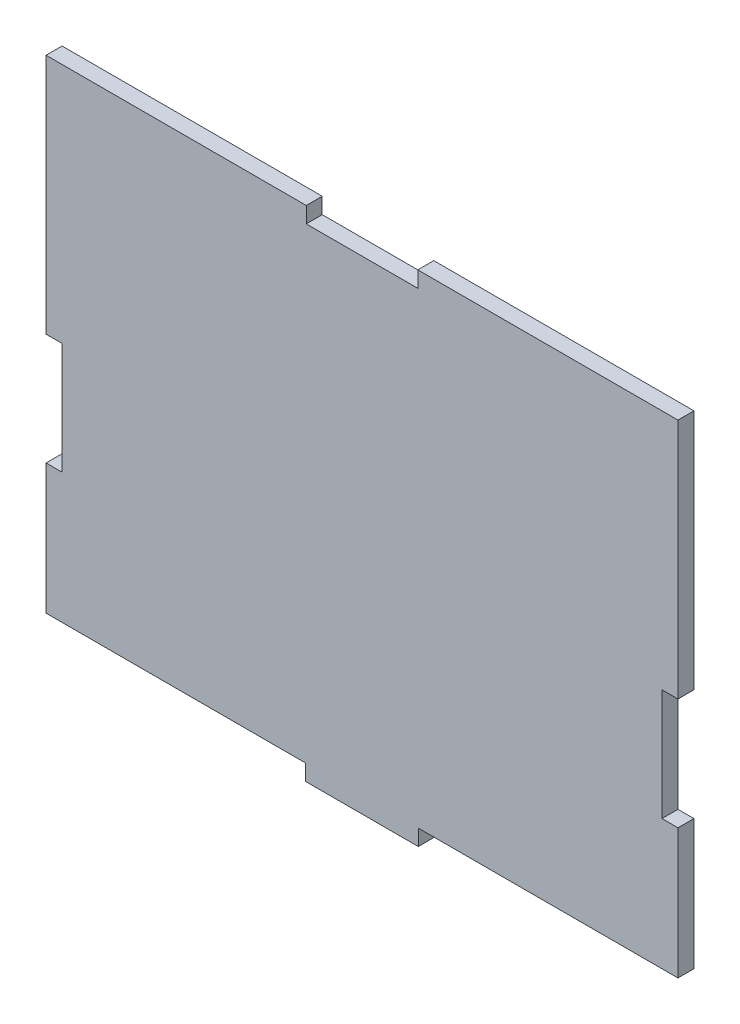
from build123d import *

# Parameters (mm, degrees)
BOSS_EXTRUDE1_DEPTH = 4.3


with BuildPart() as part:
    # Sketch2 → Boss-Extrude1 (new body)
    with BuildSketch(Plane.XY):
        Polygon((15, 65), (85, 65), (85, 0), (80.7, 0), (80.7, -30), (85, -30), (85, -65), (15.15, -65), (15.15, -69.3), (-15.15, -69.3), (-15.15, -65), (-85, -65), (-85, -30), (-80.7, -30), (-80.7, 0), (-85, 0), (-85, 65), (-15, 65), (-15, 60.7), (15, 60.7), align=None)
    extrude(amount=BOSS_EXTRUDE1_DEPTH)


solid = part.part
